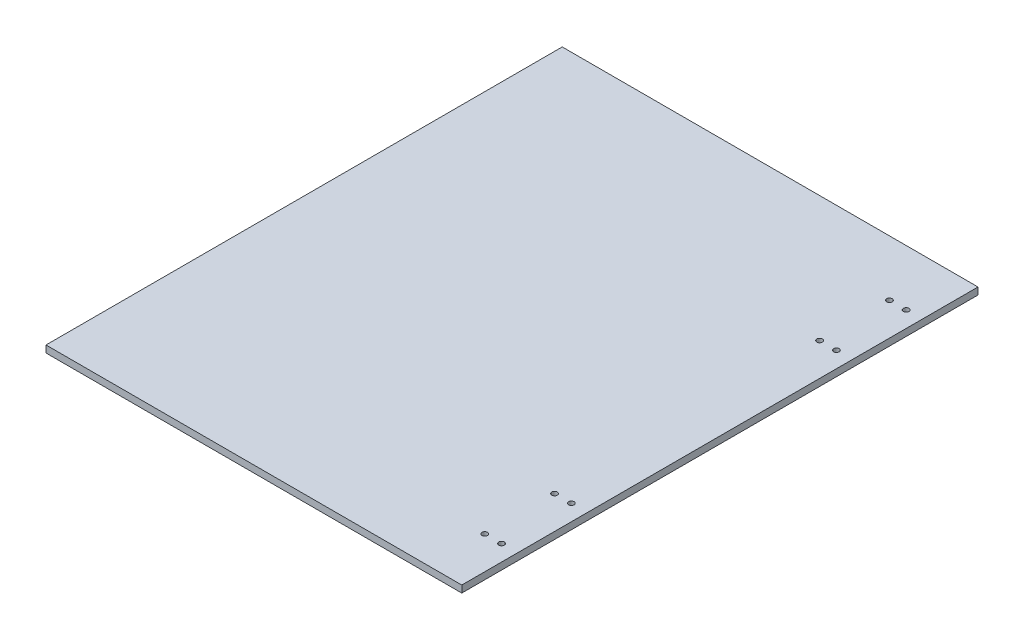
from build123d import *

# Parameters (mm, degrees)
SKETCH_1_W          = 298
SKETCH_1_H          = 370
EXTRUDE_1_DEPTH     = 5
SKETCH_2_R          = 2
CUT_EXTRUDE_1_DEPTH = 240.963669125


with BuildPart() as part:
    # 스케치1 → 보스-돌출1 (new body)
    with BuildSketch(Plane(origin=(0, 0, 0), x_dir=(1, 0, 0), z_dir=(0, 1, 0))):
        with Locations((-3.75, 0)):
            Rectangle(SKETCH_1_W, SKETCH_1_H)
    extrude(amount=EXTRUDE_1_DEPTH)

    # 스케치2 → 컷-돌출1 (cut, through all)
    with BuildSketch(Plane(origin=(0, 5, 0), x_dir=(1, 0, 0), z_dir=(0, 1, 0))):
        with Locations(Location((121.75, 145, 0), (0, 0, 270))):
            Circle(SKETCH_2_R)
        with Locations(Location((133.75, 145, 0), (0, 0, 270))):
            Circle(SKETCH_2_R)
        with Locations(Location((121.75, 95, 0), (0, 0, 270))):
            Circle(SKETCH_2_R)
        with Locations(Location((133.75, 95, 0), (0, 0, 270))):
            Circle(SKETCH_2_R)
        with Locations(Location((133.75, -95, 0), (0, 0, 270))):
            Circle(SKETCH_2_R)
        with Locations(Location((121.75, -95, 0), (0, 0, 270))):
            Circle(SKETCH_2_R)
        with Locations(Location((133.75, -145, 0), (0, 0, 270))):
            Circle(SKETCH_2_R)
        with Locations(Location((121.75, -145, 0), (0, 0, 270))):
            Circle(SKETCH_2_R)
    extrude(amount=-CUT_EXTRUDE_1_DEPTH, mode=Mode.SUBTRACT)


solid = part.part
